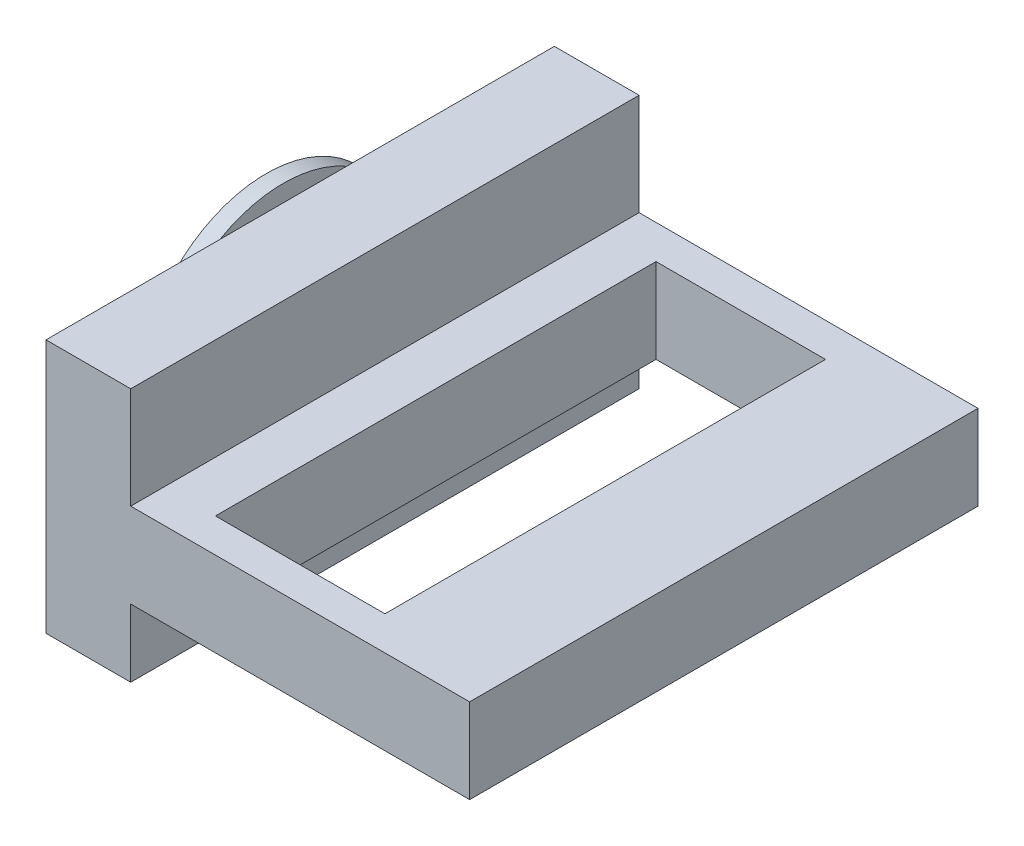
from build123d import *

# Parameters (mm, degrees)
BOSS_EXTRUDE1_DEPTH = 30
SKETCH2_W           = 10
SKETCH2_H           = 26
CUT_EXTRUDE1_DEPTH  = 5
SKETCH3_R           = 5
BOSS_EXTRUDE2_DEPTH = 1
SKETCH4_R           = 7.5
BOSS_EXTRUDE3_DEPTH = 1
SKETCH5_R           = 5
BOSS_EXTRUDE4_DEPTH = 1


with BuildPart() as part:
    # Sketch1 → Boss-Extrude1 (new body)
    with BuildSketch(Plane.XY):
        Polygon((-10.17985471, 6.184971098), (-10.17985471, -8.815028902), (-5.17985471, -8.815028902), (-5.17985471, -4.815028902), (14.82014529, -4.815028902), (14.82014529, 0.184971098), (-5.17985471, 0.184971098), (-5.17985471, 6.184971098), align=None)
    extrude(amount=BOSS_EXTRUDE1_DEPTH)

    # Sketch2 → Cut-Extrude1 (cut)
    with BuildSketch(Plane(origin=(0, 0.184971098, 0), x_dir=(1, 0, 0), z_dir=(0, 1, 0))):
        with Locations((2.82014529, -15)):
            Rectangle(SKETCH2_W, SKETCH2_H)
    extrude(amount=-CUT_EXTRUDE1_DEPTH, mode=Mode.SUBTRACT)

    # Sketch3 → Boss-Extrude2 (add)
    with BuildSketch(Plane.ZY.offset(10.17985471)):
        with Locations((15, -1.315028902)):
            Circle(SKETCH3_R)
    extrude(amount=BOSS_EXTRUDE2_DEPTH)

    # Sketch4 → Boss-Extrude3 (add)
    with BuildSketch(Plane.ZY.offset(11.17985471)):
        with Locations((15, -1.315028902)):
            Circle(SKETCH4_R)
    extrude(amount=BOSS_EXTRUDE3_DEPTH)

    # Sketch5 → Boss-Extrude4 (add)
    with BuildSketch(Plane.ZY.offset(12.17985471)):
        with Locations((15, -1.315028902)):
            Circle(SKETCH5_R)
    extrude(amount=BOSS_EXTRUDE4_DEPTH)


solid = part.part
